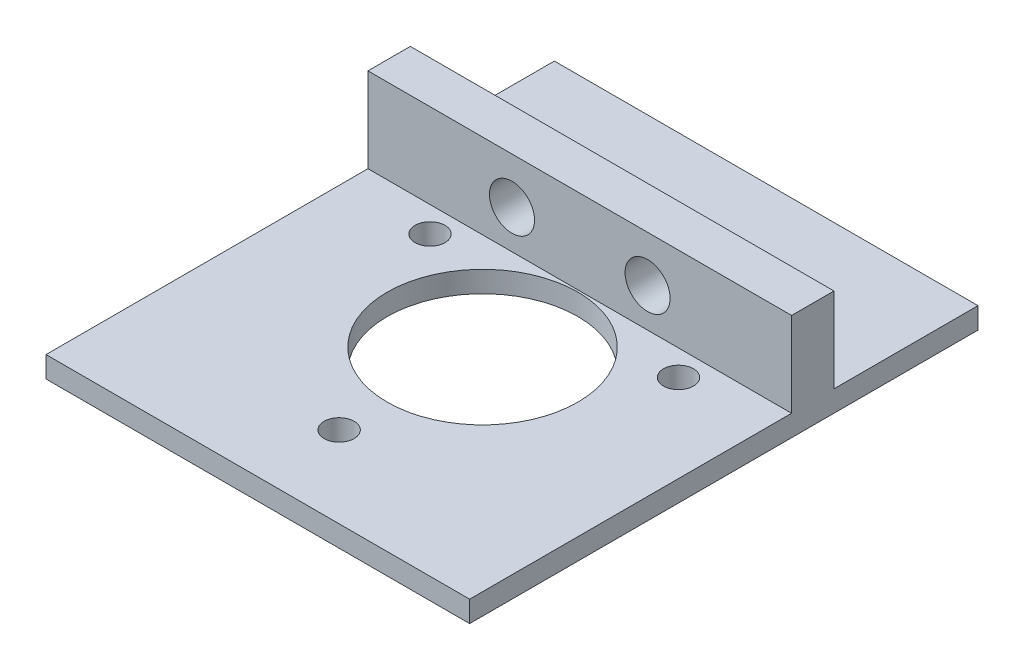
from build123d import *

# Parameters (mm, degrees)
BOSS_EXTRUDE1_DEPTH     = 63.5
SKETCH2_R               = 14.2875
CUT_EXTRUDE1_DEPTH      = 100.9999
M4_CLEARANCE_HOLE1_D    = 4.5
F_1_4_CLEARANCE_HOLE1_D = 6.7564


with BuildPart() as part:
    # Sketch1 → Boss-Extrude1 (new body)
    with BuildSketch(Plane(origin=(0, 0, 0), x_dir=(0, 0, -1), z_dir=(1, 0, 0))):
        Polygon((0, 0), (0, 3.175), (48.26, 3.175), (48.26, 15.875), (54.61, 15.875), (54.61, 3.175), (76.2, 3.175), (76.2, 0), align=None)
    extrude(amount=BOSS_EXTRUDE1_DEPTH)

    # Sketch2 → Cut-Extrude1 (cut, through all)
    with BuildSketch(Plane(origin=(0, 3.175, 0), x_dir=(1, 0, 0), z_dir=(0, 1, 0))):
        with Locations(Location((31.75, 33.685553713, 0), (0, 0, 270))):
            Circle(SKETCH2_R)
    extrude(amount=-CUT_EXTRUDE1_DEPTH, mode=Mode.SUBTRACT)

    # M4 Clearance Hole1 (through all)
    with Locations(Plane(origin=(0, 0, 0), x_dir=(-1, 0, 0), z_dir=(0, -1, 0))):
        with Locations((-31.75, 12.185553713), (-50.369546181, 44.435553713), (-13.130453819, 44.435553713)):
            Hole(M4_CLEARANCE_HOLE1_D / 2)

    # 1/4 Clearance Hole1 (through all)
    with Locations(Plane.XY.offset(-48.26)):
        with Locations((41.91, 8.9662), (21.59, 8.9662)):
            Hole(F_1_4_CLEARANCE_HOLE1_D / 2)


solid = part.part
